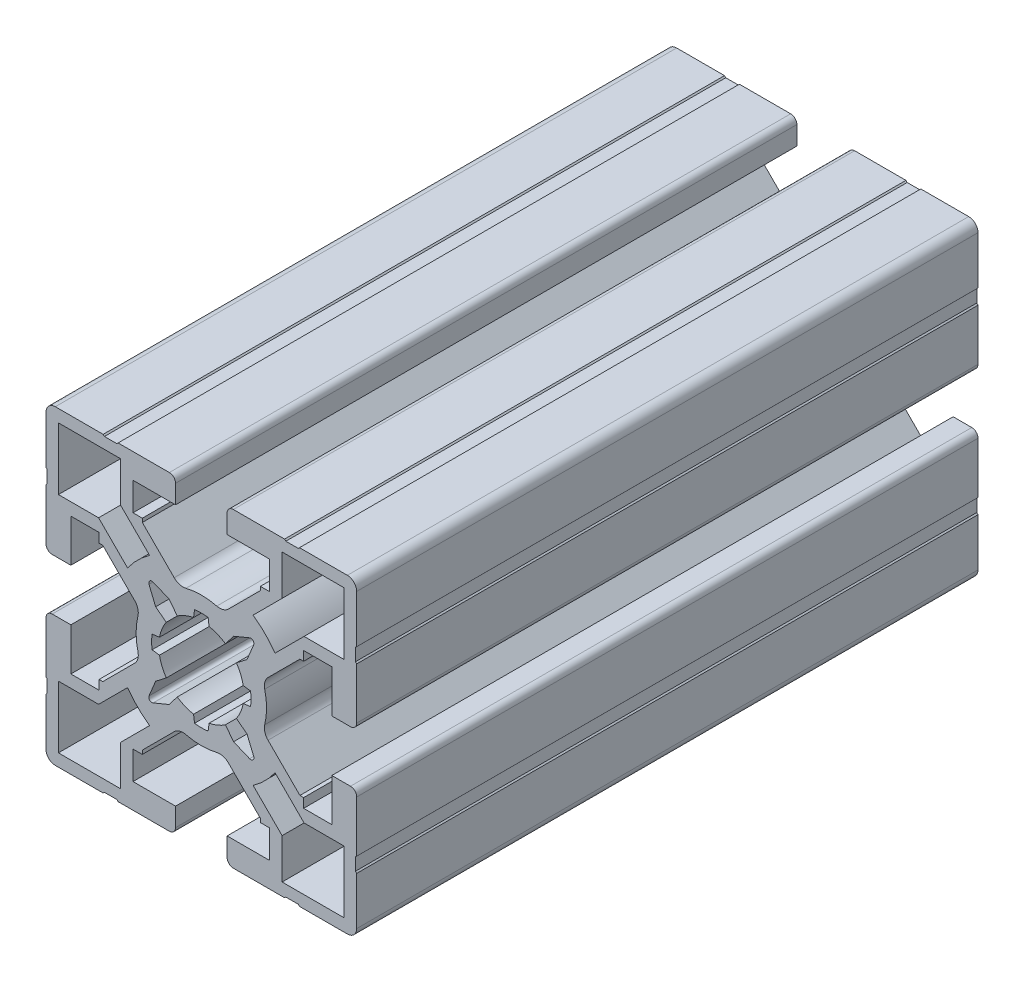
from build123d import *

# Parameters (mm, degrees)
RESSALTO_EXTRUS_O1_DEPTH = 500
CUT_EXTRUDE1_START       = -400
CUT_EXTRUDE1_DEPTH       = 400


with BuildPart() as part:
    # Model → Ressalto-extrusão1 (new body)
    with BuildSketch(Plane.XY):
        with BuildLine():
            Line((-23.5, -25), (-15.8, -25))
            Line((-15.8, -25), (-15.6, -24.8))
            Line((-15.6, -24.8), (-13.6, -24.8))
            Line((-13.6, -24.8), (-13.4, -25))
            Line((-13.4, -25), (-5.15, -25))
            ThreePointArc((-5.15, -25), (-4.442893219, -24.707106781), (-4.15, -24))
            Line((-4.15, -24), (-4.15, -21))
            Line((-4.15, -21), (-11, -21))
            Line((-11, -21), (-11, -16.463961031))
            Line((-11, -16.463961031), (-9.5, -16.463961031))
            Line((-9.5, -16.463961031), (-9.5, -15.863961031))
            Line((-9.5, -15.863961031), (-4.36785392, -10.731814951))
            ThreePointArc((-4.36785392, -10.731814951), (-3.493702835, -10.220325389), (-2.4810579, -10.202663951))
            ThreePointArc((-2.4810579, -10.202663951), (0, -10.5), (2.4810579, -10.202663951))
            ThreePointArc((2.4810579, -10.202663951), (3.493702835, -10.220325389), (4.36785392, -10.731814951))
            Line((4.36785392, -10.731814951), (9.5, -15.863961031))
            Line((9.5, -15.863961031), (9.5, -16.463961031))
            Line((9.5, -16.463961031), (11, -16.463961031))
            Line((11, -16.463961031), (11, -21))
            Line((11, -21), (4.15, -21))
            Line((4.15, -21), (4.15, -24))
            ThreePointArc((4.15, -24), (4.442893219, -24.707106781), (5.15, -25))
            Line((5.15, -25), (13.4, -25))
            Line((13.4, -25), (13.6, -24.8))
            Line((13.6, -24.8), (15.6, -24.8))
            Line((15.6, -24.8), (15.8, -25))
            Line((15.8, -25), (23.5, -25))
            ThreePointArc((23.5, -25), (24.560660172, -24.560660172), (25, -23.5))
            Line((25, -23.5), (25, -15.8))
            Line((25, -15.8), (24.8, -15.6))
            Line((24.8, -15.6), (24.8, -13.6))
            Line((24.8, -13.6), (25, -13.4))
            Line((25, -13.4), (25, -5.15))
            ThreePointArc((25, -5.15), (24.707106781, -4.442893219), (24, -4.15))
            Line((24, -4.15), (21, -4.15))
            Line((21, -4.15), (21, -11))
            Line((21, -11), (16.463961031, -11))
            Line((16.463961031, -11), (16.463961031, -9.5))
            Line((16.463961031, -9.5), (15.863961031, -9.5))
            Line((15.863961031, -9.5), (10.731814951, -4.36785392))
            ThreePointArc((10.731814951, -4.36785392), (10.220325389, -3.493702835), (10.202663951, -2.4810579))
            ThreePointArc((10.202663951, -2.4810579), (10.5, 0), (10.202663951, 2.4810579))
            ThreePointArc((10.202663951, 2.4810579), (10.220325389, 3.493702835), (10.731814951, 4.36785392))
            Line((10.731814951, 4.36785392), (15.863961031, 9.5))
            Line((15.863961031, 9.5), (16.463961031, 9.5))
            Line((16.463961031, 9.5), (16.463961031, 11))
            Line((16.463961031, 11), (21, 11))
            Line((21, 11), (21, 4.15))
            Line((21, 4.15), (24, 4.15))
            ThreePointArc((24, 4.15), (24.707106781, 4.442893219), (25, 5.15))
            Line((25, 5.15), (25, 13.4))
            Line((25, 13.4), (24.8, 13.6))
            Line((24.8, 13.6), (24.8, 15.6))
            Line((24.8, 15.6), (25, 15.8))
            Line((25, 15.8), (25, 23.5))
            ThreePointArc((25, 23.5), (24.560660172, 24.560660172), (23.5, 25))
            Line((23.5, 25), (15.8, 25))
            Line((15.8, 25), (15.6, 24.8))
            Line((15.6, 24.8), (13.6, 24.8))
            Line((13.6, 24.8), (13.4, 25))
            Line((13.4, 25), (5.15, 25))
            ThreePointArc((5.15, 25), (4.442893219, 24.707106781), (4.15, 24))
            Line((4.15, 24), (4.15, 21))
            Line((4.15, 21), (11, 21))
            Line((11, 21), (11, 16.463961031))
            Line((11, 16.463961031), (9.5, 16.463961031))
            Line((9.5, 16.463961031), (9.5, 15.863961031))
            Line((9.5, 15.863961031), (4.36785392, 10.731814951))
            ThreePointArc((4.36785392, 10.731814951), (3.493702835, 10.220325389), (2.4810579, 10.202663951))
            ThreePointArc((2.4810579, 10.202663951), (0, 10.5), (-2.4810579, 10.202663951))
            ThreePointArc((-2.4810579, 10.202663951), (-3.493702835, 10.220325389), (-4.36785392, 10.731814951))
            Line((-4.36785392, 10.731814951), (-9.5, 15.863961031))
            Line((-9.5, 15.863961031), (-9.5, 16.463961031))
            Line((-9.5, 16.463961031), (-11, 16.463961031))
            Line((-11, 16.463961031), (-11, 21))
            Line((-11, 21), (-4.15, 21))
            Line((-4.15, 21), (-4.15, 24))
            ThreePointArc((-4.15, 24), (-4.442893219, 24.707106781), (-5.15, 25))
            Line((-5.15, 25), (-13.4, 25))
            Line((-13.4, 25), (-13.6, 24.8))
            Line((-13.6, 24.8), (-15.6, 24.8))
            Line((-15.6, 24.8), (-15.8, 25))
            Line((-15.8, 25), (-23.5, 25))
            ThreePointArc((-23.5, 25), (-24.560660172, 24.560660172), (-25, 23.5))
            Line((-25, 23.5), (-25, 15.8))
            Line((-25, 15.8), (-24.8, 15.6))
            Line((-24.8, 15.6), (-24.8, 13.6))
            Line((-24.8, 13.6), (-25, 13.4))
            Line((-25, 13.4), (-25, 5.15))
            ThreePointArc((-25, 5.15), (-24.707106781, 4.442893219), (-24, 4.15))
            Line((-24, 4.15), (-21, 4.15))
            Line((-21, 4.15), (-21, 11))
            Line((-21, 11), (-16.463961031, 11))
            Line((-16.463961031, 11), (-16.463961031, 9.5))
            Line((-16.463961031, 9.5), (-15.863961031, 9.5))
            Line((-15.863961031, 9.5), (-10.731814951, 4.36785392))
            ThreePointArc((-10.731814951, 4.36785392), (-10.220325389, 3.493702835), (-10.202663951, 2.4810579))
            ThreePointArc((-10.202663951, 2.4810579), (-10.5, 0), (-10.202663951, -2.4810579))
            ThreePointArc((-10.202663951, -2.4810579), (-10.220325389, -3.493702835), (-10.731814951, -4.36785392))
            Line((-10.731814951, -4.36785392), (-15.863961031, -9.5))
            Line((-15.863961031, -9.5), (-16.463961031, -9.5))
            Line((-16.463961031, -9.5), (-16.463961031, -11))
            Line((-16.463961031, -11), (-21, -11))
            Line((-21, -11), (-21, -4.15))
            Line((-21, -4.15), (-24, -4.15))
            ThreePointArc((-24, -4.15), (-24.707106781, -4.442893219), (-25, -5.15))
            Line((-25, -5.15), (-25, -13.4))
            Line((-25, -13.4), (-24.8, -13.6))
            Line((-24.8, -13.6), (-24.8, -15.6))
            Line((-24.8, -15.6), (-25, -15.8))
            Line((-25, -15.8), (-25, -23.5))
            ThreePointArc((-25, -23.5), (-24.560660172, -24.560660172), (-23.5, -25))
        make_face()
        with BuildLine():
            Line((11.867271891, 8.331737985), (16.535533906, 13))
            Line((16.535533906, 13), (23, 13))
            Line((23, 13), (23, 23))
            Line((23, 23), (13, 23))
            Line((13, 23), (13, 16.535533906))
            Line((13, 16.535533906), (8.331737985, 11.867271891))
            ThreePointArc((8.331737985, 11.867271891), (10.253048327, 10.253048327), (11.867271891, 8.331737985))
        make_face(mode=Mode.SUBTRACT)
        with BuildLine():
            Line((-13, 23), (-13, 16.535533906))
            Line((-13, 16.535533906), (-8.331737985, 11.867271891))
            ThreePointArc((-8.331737985, 11.867271891), (-10.253048327, 10.253048327), (-11.867271891, 8.331737985))
            Line((-11.867271891, 8.331737985), (-16.535533906, 13))
            Line((-16.535533906, 13), (-23, 13))
            Line((-23, 13), (-23, 23))
            Line((-23, 23), (-13, 23))
        make_face(mode=Mode.SUBTRACT)
        with BuildLine():
            Line((-13, -23), (-23, -23))
            Line((-23, -23), (-23, -13))
            Line((-23, -13), (-16.535533906, -13))
            Line((-16.535533906, -13), (-11.867271891, -8.331737985))
            ThreePointArc((-11.867271891, -8.331737985), (-10.253048327, -10.253048327), (-8.331737985, -11.867271891))
            Line((-8.331737985, -11.867271891), (-13, -16.535533906))
            Line((-13, -16.535533906), (-13, -23))
        make_face(mode=Mode.SUBTRACT)
        with BuildLine():
            Line((8.331737985, -11.867271891), (13, -16.535533906))
            Line((13, -16.535533906), (13, -23))
            Line((13, -23), (23, -23))
            Line((23, -23), (23, -13))
            Line((23, -13), (16.535533906, -13))
            Line((16.535533906, -13), (11.867271891, -8.331737985))
            ThreePointArc((11.867271891, -8.331737985), (10.253048327, -10.253048327), (8.331737985, -11.867271891))
        make_face(mode=Mode.SUBTRACT)
        with BuildLine():
            Line((-7.769449291, -8.422730773), (-5.188685539, -7.353743426))
            Line((-5.188685539, -7.353743426), (-3.878468883, -5.646235836))
            ThreePointArc((-3.878468883, -5.646235836), (-2.621381512, -6.328574798), (-1.25, -6.734983296))
            Line((-1.25, -6.734983296), (-1.093339775, -7.924935844))
            ThreePointArc((-1.093339775, -7.924935844), (0, -8), (1.093339775, -7.924935844))
            Line((1.093339775, -7.924935844), (1.25, -6.734983296))
            ThreePointArc((1.25, -6.734983296), (2.621381512, -6.328574798), (3.878468883, -5.646235836))
            Line((3.878468883, -5.646235836), (5.188685539, -7.353743426))
            Line((5.188685539, -7.353743426), (7.769449291, -8.422730773))
            ThreePointArc((7.769449291, -8.422730773), (8.314344398, -8.314344398), (8.422730773, -7.769449291))
            Line((8.422730773, -7.769449291), (7.353743426, -5.188685539))
            Line((7.353743426, -5.188685539), (5.646235836, -3.878468883))
            ThreePointArc((5.646235836, -3.878468883), (6.328574798, -2.621381512), (6.734983296, -1.25))
            Line((6.734983296, -1.25), (7.924935844, -1.093339775))
            ThreePointArc((7.924935844, -1.093339775), (8, 0), (7.924935844, 1.093339775))
            Line((7.924935844, 1.093339775), (6.734983296, 1.25))
            ThreePointArc((6.734983296, 1.25), (6.328574798, 2.621381512), (5.646235836, 3.878468883))
            Line((5.646235836, 3.878468883), (7.353743426, 5.188685539))
            Line((7.353743426, 5.188685539), (8.422730773, 7.769449291))
            ThreePointArc((8.422730773, 7.769449291), (8.314344398, 8.314344398), (7.769449291, 8.422730773))
            Line((7.769449291, 8.422730773), (5.188685539, 7.353743426))
            Line((5.188685539, 7.353743426), (3.878468883, 5.646235836))
            ThreePointArc((3.878468883, 5.646235836), (2.621381512, 6.328574798), (1.25, 6.734983296))
            Line((1.25, 6.734983296), (1.093339775, 7.924935844))
            ThreePointArc((1.093339775, 7.924935844), (0, 8), (-1.093339775, 7.924935844))
            Line((-1.093339775, 7.924935844), (-1.25, 6.734983296))
            ThreePointArc((-1.25, 6.734983296), (-2.621381512, 6.328574798), (-3.878468883, 5.646235836))
            Line((-3.878468883, 5.646235836), (-5.188685539, 7.353743426))
            Line((-5.188685539, 7.353743426), (-7.769449291, 8.422730773))
            ThreePointArc((-7.769449291, 8.422730773), (-8.314344398, 8.314344398), (-8.422730773, 7.769449291))
            Line((-8.422730773, 7.769449291), (-7.353743426, 5.188685539))
            Line((-7.353743426, 5.188685539), (-5.646235836, 3.878468883))
            ThreePointArc((-5.646235836, 3.878468883), (-6.328574798, 2.621381512), (-6.734983296, 1.25))
            Line((-6.734983296, 1.25), (-7.924935844, 1.093339775))
            ThreePointArc((-7.924935844, 1.093339775), (-8, 0), (-7.924935844, -1.093339775))
            Line((-7.924935844, -1.093339775), (-6.734983296, -1.25))
            ThreePointArc((-6.734983296, -1.25), (-6.328574798, -2.621381512), (-5.646235836, -3.878468883))
            Line((-5.646235836, -3.878468883), (-7.353743426, -5.188685539))
            Line((-7.353743426, -5.188685539), (-8.422730773, -7.769449291))
            ThreePointArc((-8.422730773, -7.769449291), (-8.451183647, -8.058336168), (-8.314344398, -8.314344398))
            ThreePointArc((-8.314344398, -8.314344398), (-8.058336168, -8.451183647), (-7.769449291, -8.422730773))
        make_face(mode=Mode.SUBTRACT)
    extrude(amount=RESSALTO_EXTRUS_O1_DEPTH)

    # Sketch1 → Cut-Extrude1 (cut)
    with BuildSketch(Plane.XY.offset(500).offset(CUT_EXTRUDE1_START)):
        with BuildLine():
            Line((-4.15, -24), (-4.15, -21))
            Line((-4.15, -21), (-11, -21))
            Line((-11, -21), (-11, -16.463961031))
            Line((-11, -16.463961031), (-9.5, -16.463961031))
            Line((-9.5, -16.463961031), (-9.5, -15.863961031))
            Line((-9.5, -15.863961031), (-4.36785392, -10.731814951))
            ThreePointArc((-4.36785392, -10.731814951), (-3.493702835, -10.220325389), (-2.4810579, -10.202663951))
            ThreePointArc((-2.4810579, -10.202663951), (0, -10.5), (2.4810579, -10.202663951))
            ThreePointArc((2.4810579, -10.202663951), (3.493702835, -10.220325389), (4.36785392, -10.731814951))
            Line((4.36785392, -10.731814951), (9.5, -15.863961031))
            Line((9.5, -15.863961031), (9.5, -16.463961031))
            Line((9.5, -16.463961031), (11, -16.463961031))
            Line((11, -16.463961031), (11, -21))
            Line((11, -21), (4.15, -21))
            Line((4.15, -21), (4.15, -24))
            ThreePointArc((4.15, -24), (4.442893219, -24.707106781), (5.15, -25))
            Line((5.15, -25), (13.4, -25))
            Line((13.4, -25), (13.6, -24.8))
            Line((13.6, -24.8), (15.6, -24.8))
            Line((15.6, -24.8), (15.8, -25))
            Line((15.8, -25), (23.5, -25))
            ThreePointArc((23.5, -25), (24.560660172, -24.560660172), (25, -23.5))
            Line((25, -23.5), (25, -15.8))
            Line((25, -15.8), (24.8, -15.6))
            Line((24.8, -15.6), (24.8, -13.6))
            Line((24.8, -13.6), (25, -13.4))
            Line((25, -13.4), (25, -5.15))
            ThreePointArc((25, -5.15), (24.707106781, -4.442893219), (24, -4.15))
            Line((24, -4.15), (21, -4.15))
            Line((21, -4.15), (21, -11))
            Line((21, -11), (16.463961031, -11))
            Line((16.463961031, -11), (16.463961031, -9.5))
            Line((16.463961031, -9.5), (15.863961031, -9.5))
            Line((15.863961031, -9.5), (10.731814951, -4.36785392))
            ThreePointArc((10.731814951, -4.36785392), (10.220325389, -3.493702835), (10.202663951, -2.4810579))
            ThreePointArc((10.202663951, -2.4810579), (10.5, 0), (10.202663951, 2.4810579))
            ThreePointArc((10.202663951, 2.4810579), (10.220325389, 3.493702835), (10.731814951, 4.36785392))
            Line((10.731814951, 4.36785392), (15.863961031, 9.5))
            Line((15.863961031, 9.5), (16.463961031, 9.5))
            Line((16.463961031, 9.5), (16.463961031, 11))
            Line((16.463961031, 11), (21, 11))
            Line((21, 11), (21, 4.15))
            Line((21, 4.15), (24, 4.15))
            ThreePointArc((24, 4.15), (24.707106781, 4.442893219), (25, 5.15))
            Line((25, 5.15), (25, 13.4))
            Line((25, 13.4), (24.8, 13.6))
            Line((24.8, 13.6), (24.8, 15.6))
            Line((24.8, 15.6), (25, 15.8))
            Line((25, 15.8), (25, 23.5))
            ThreePointArc((25, 23.5), (24.560660172, 24.560660172), (23.5, 25))
            Line((23.5, 25), (15.8, 25))
            Line((15.8, 25), (15.6, 24.8))
            Line((15.6, 24.8), (13.6, 24.8))
            Line((13.6, 24.8), (13.4, 25))
            Line((13.4, 25), (5.15, 25))
            ThreePointArc((5.15, 25), (4.442893219, 24.707106781), (4.15, 24))
            Line((4.15, 24), (4.15, 21))
            Line((4.15, 21), (11, 21))
            Line((11, 21), (11, 16.463961031))
            Line((11, 16.463961031), (9.5, 16.463961031))
            Line((9.5, 16.463961031), (9.5, 15.863961031))
            Line((9.5, 15.863961031), (4.36785392, 10.731814951))
            ThreePointArc((4.36785392, 10.731814951), (3.493702835, 10.220325389), (2.4810579, 10.202663951))
            ThreePointArc((2.4810579, 10.202663951), (0, 10.5), (-2.4810579, 10.202663951))
            ThreePointArc((-2.4810579, 10.202663951), (-3.493702835, 10.220325389), (-4.36785392, 10.731814951))
            Line((-4.36785392, 10.731814951), (-9.5, 15.863961031))
            Line((-9.5, 15.863961031), (-9.5, 16.463961031))
            Line((-9.5, 16.463961031), (-11, 16.463961031))
            Line((-11, 16.463961031), (-11, 21))
            Line((-11, 21), (-4.15, 21))
            Line((-4.15, 21), (-4.15, 24))
            ThreePointArc((-4.15, 24), (-4.442893219, 24.707106781), (-5.15, 25))
            Line((-5.15, 25), (-13.4, 25))
            Line((-13.4, 25), (-13.6, 24.8))
            Line((-13.6, 24.8), (-15.6, 24.8))
            Line((-15.6, 24.8), (-15.8, 25))
            Line((-15.8, 25), (-23.5, 25))
            ThreePointArc((-23.5, 25), (-24.560660172, 24.560660172), (-25, 23.5))
            Line((-25, 23.5), (-25, 15.8))
            Line((-25, 15.8), (-24.8, 15.6))
            Line((-24.8, 15.6), (-24.8, 13.6))
            Line((-24.8, 13.6), (-25, 13.4))
            Line((-25, 13.4), (-25, 5.15))
            ThreePointArc((-25, 5.15), (-24.707106781, 4.442893219), (-24, 4.15))
            Line((-24, 4.15), (-21, 4.15))
            Line((-21, 4.15), (-21, 11))
            Line((-21, 11), (-16.463961031, 11))
            Line((-16.463961031, 11), (-16.463961031, 9.5))
            Line((-16.463961031, 9.5), (-15.863961031, 9.5))
            Line((-15.863961031, 9.5), (-10.731814951, 4.36785392))
            ThreePointArc((-10.731814951, 4.36785392), (-10.220325389, 3.493702835), (-10.202663951, 2.4810579))
            ThreePointArc((-10.202663951, 2.4810579), (-10.5, 0), (-10.202663951, -2.4810579))
            ThreePointArc((-10.202663951, -2.4810579), (-10.220325389, -3.493702835), (-10.731814951, -4.36785392))
            Line((-10.731814951, -4.36785392), (-15.863961031, -9.5))
            Line((-15.863961031, -9.5), (-16.463961031, -9.5))
            Line((-16.463961031, -9.5), (-16.463961031, -11))
            Line((-16.463961031, -11), (-21, -11))
            Line((-21, -11), (-21, -4.15))
            Line((-21, -4.15), (-24, -4.15))
            ThreePointArc((-24, -4.15), (-24.707106781, -4.442893219), (-25, -5.15))
            Line((-25, -5.15), (-25, -13.4))
            Line((-25, -13.4), (-24.8, -13.6))
            Line((-24.8, -13.6), (-24.8, -15.6))
            Line((-24.8, -15.6), (-25, -15.8))
            Line((-25, -15.8), (-25, -23.5))
            ThreePointArc((-25, -23.5), (-24.560660172, -24.560660172), (-23.5, -25))
            Line((-23.5, -25), (-15.8, -25))
            Line((-15.8, -25), (-15.6, -24.8))
            Line((-15.6, -24.8), (-13.6, -24.8))
            Line((-13.6, -24.8), (-13.4, -25))
            Line((-13.4, -25), (-5.15, -25))
            ThreePointArc((-5.15, -25), (-4.442893219, -24.707106781), (-4.15, -24))
        make_face()
    extrude(amount=CUT_EXTRUDE1_DEPTH, mode=Mode.SUBTRACT)


solid = part.part
